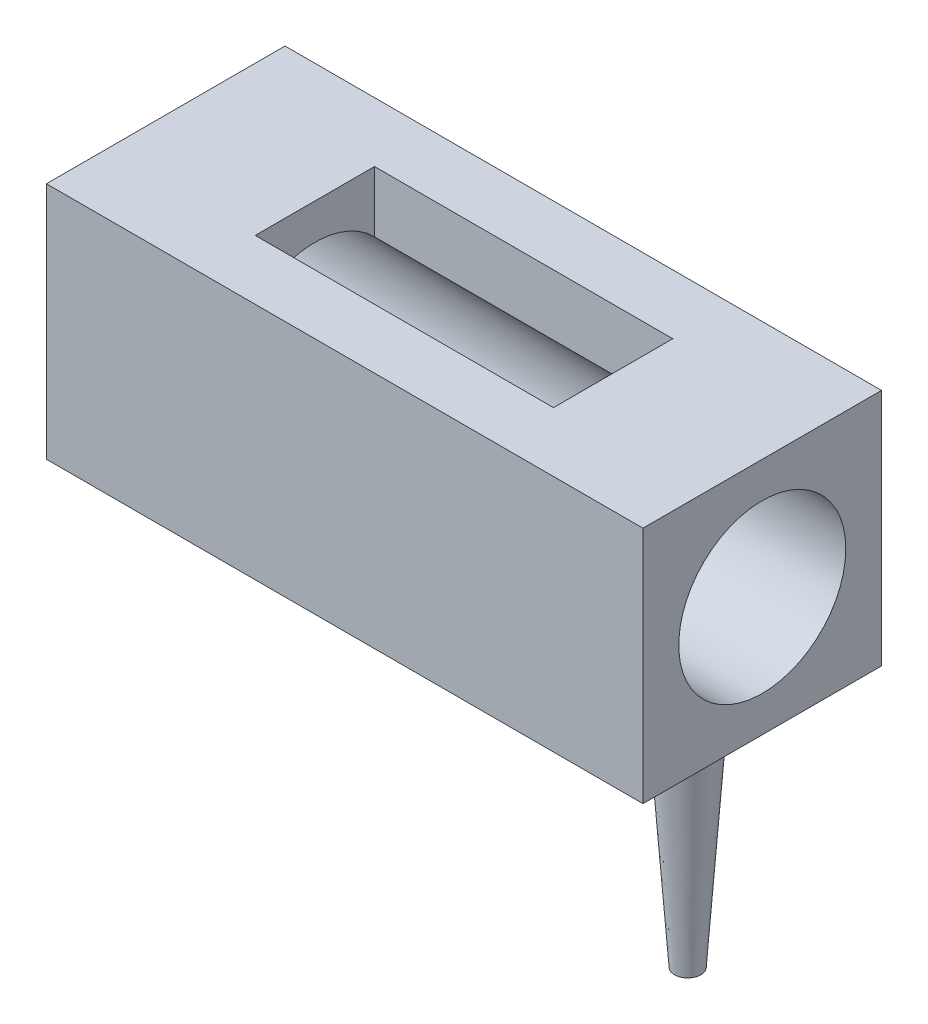
from build123d import *

# Parameters (mm, degrees)
CROQUIS1_W              = 1000
CROQUIS1_H              = 400
SALIENTE_EXTRUIR1_DEPTH = 400
CROQUIS2_R              = 140
CORTAR_EXTRUIR1_DEPTH   = 1000
CROQUIS3_W              = 500
CROQUIS3_H              = 200
CORTAR_EXTRUIR2_DEPTH   = 400
CROQUIS4_R              = 50
SALIENTE_EXTRUIR2_DEPTH = 400
SALIENTE_EXTRUIR2_TAPER = 4


with BuildPart() as part:
    # Croquis1 → Saliente-Extruir1 (new body)
    with BuildSketch(Plane.XY):
        with Locations((500, 200)):
            Rectangle(CROQUIS1_W, CROQUIS1_H)
    extrude(amount=SALIENTE_EXTRUIR1_DEPTH)

    # Croquis2 → Cortar-Extruir1 (cut)
    with BuildSketch(Plane(origin=(1000, 0, 0), x_dir=(0, 0, -1), z_dir=(1, 0, 0))):
        with Locations((-200, 200)):
            Circle(CROQUIS2_R)
    extrude(amount=-CORTAR_EXTRUIR1_DEPTH, mode=Mode.SUBTRACT)

    # Croquis3 → Cortar-Extruir2 (cut)
    with BuildSketch(Plane.XZ):
        with Locations((500, 200)):
            Rectangle(CROQUIS3_W, CROQUIS3_H)
    extrude(amount=-CORTAR_EXTRUIR2_DEPTH, mode=Mode.SUBTRACT)

    # Croquis4 → Saliente-Extruir2 (add)
    with BuildSketch(Plane.XZ):
        with Locations((875, 200)):
            Circle(CROQUIS4_R)
    extrude(amount=SALIENTE_EXTRUIR2_DEPTH, taper=SALIENTE_EXTRUIR2_TAPER)


solid = part.part
